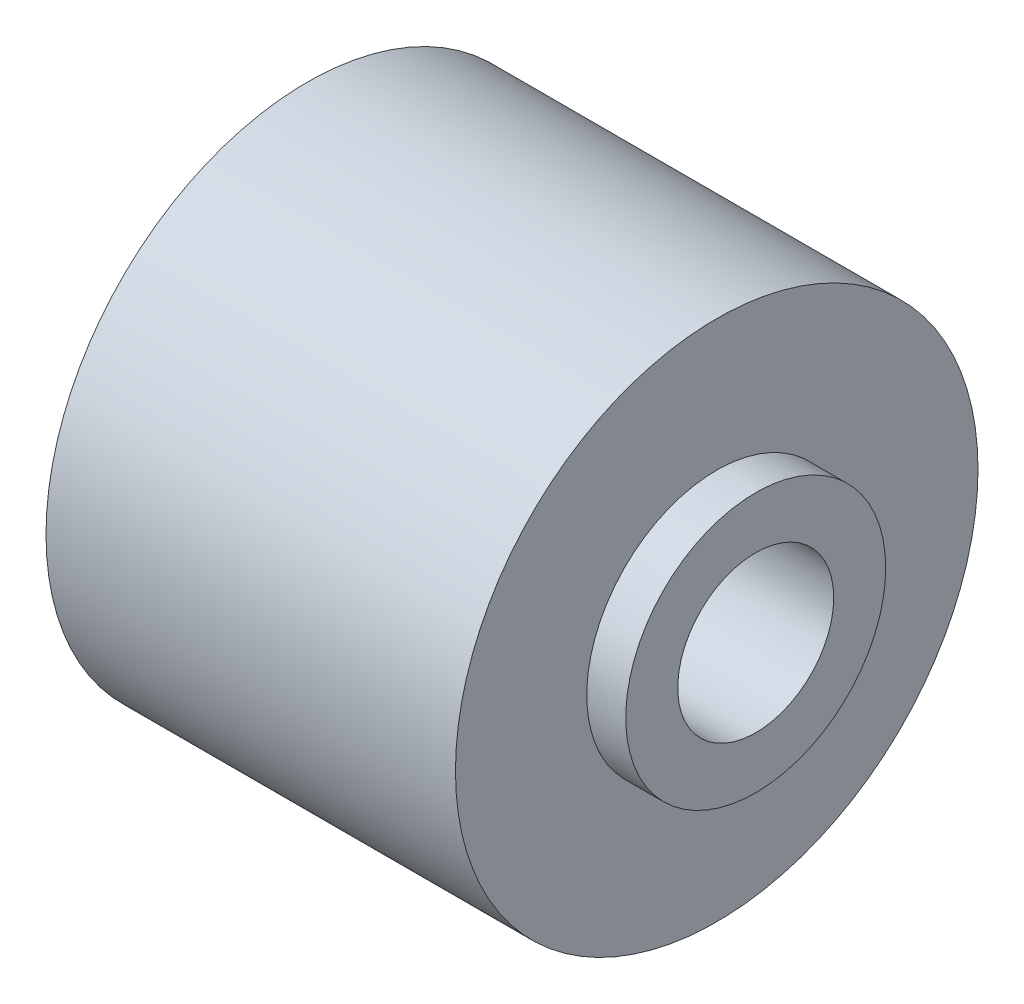
from build123d import *

# Parameters (mm, degrees)
SZKIC1_W   = 31.5
SZKIC1_H   = 14.1
SZKIC1_W_2 = 3
SZKIC1_H_2 = 4


with BuildPart() as part:
    # Szkic1 → Obrót1 (revolve)
    with BuildSketch(Plane.XY, mode=Mode.PRIVATE) as obr_t1_sk:
        with Locations((0, 13.05)):
            Rectangle(SZKIC1_W, SZKIC1_H)
        with Locations((-17.25, 8)):
            Rectangle(SZKIC1_W_2, SZKIC1_H_2)
        with Locations((17.25, 8)):
            Rectangle(SZKIC1_W_2, SZKIC1_H_2)
    revolve(obr_t1_sk.sketch.rotate(Axis((0, 0, 0), (-1, 0, 0)), 90), axis=Axis((0, 0, 0), (-1, 0, 0)))


solid = part.part
